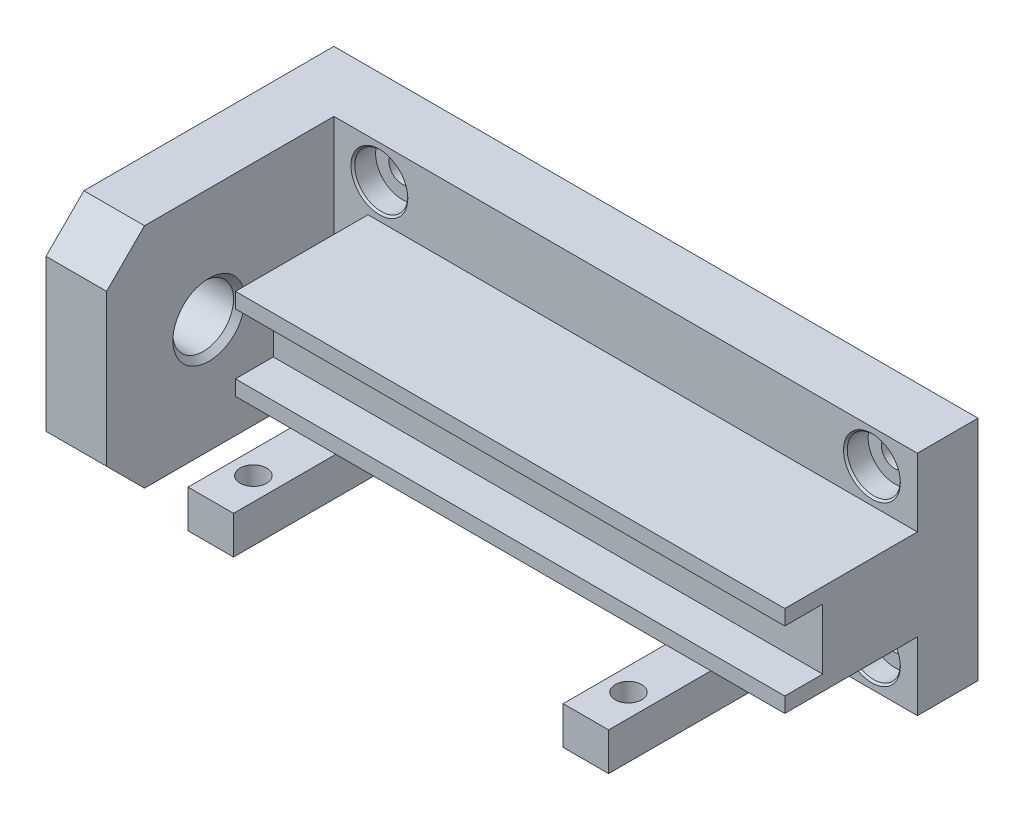
from build123d import *

# Parameters (mm, degrees)
CROQUIS1_W                                           = 85
CROQUIS1_H                                           = 30
EXTRUIR1_DEPTH                                       = 8
CROQUIS2_W                                           = 8
CROQUIS2_H                                           = 30
EXTRUIR2_DEPTH                                       = 30
CROQUIS3_W                                           = 72.5
CROQUIS3_H                                           = 12
EXTRUIR3_DEPTH                                       = 17.5
CROQUIS4_W                                           = 5
CROQUIS4_H                                           = 8
CORTAR_EXTRUIR1_DEPTH                                = 72.5
CHAFL_N1_SIZE                                        = 5
CROQUIS5_R                                           = 4
CORTAR_EXTRUIR2_DEPTH                                = 20
CHAFL_N2_SIZE                                        = 0.75
REFRENTADO_PARA_TORNILLO_DE_CABEZA_ALLEN_D           = 3.5
REFRENTADO_PARA_TORNILLO_DE_CABEZA_ALLEN_CBORE_D     = 7
REFRENTADO_PARA_TORNILLO_DE_CABEZA_ALLEN_CBORE_DEPTH = 3
CHAFL_N3_SIZE                                        = 0.25
CROQUIS9_W                                           = 6
CROQUIS9_H                                           = 5
SALIENTE_EXTRUIR1_DEPTH                              = 30
CROQUIS10_R                                          = 1.75
CORTAR_EXTRUIR3_DEPTH                                = 5
CROQUIS11_R                                          = 1.75
CORTAR_EXTRUIR4_DEPTH                                = 5


with BuildPart() as part:
    # Croquis1 → Extruir1 (new body)
    with BuildSketch(Plane.XY):
        Rectangle(CROQUIS1_W, CROQUIS1_H)
    extrude(amount=EXTRUIR1_DEPTH)

    # Croquis2 → Extruir2 (add)
    with BuildSketch(Plane.XY.offset(8)):
        with Locations((-38.5, 0)):
            Rectangle(CROQUIS2_W, CROQUIS2_H)
    extrude(amount=EXTRUIR2_DEPTH)

    # Croquis3 → Extruir3 (add)
    with BuildSketch(Plane.XY.offset(8)):
        with Locations((6.25, 0)):
            Rectangle(CROQUIS3_W, CROQUIS3_H)
    extrude(amount=EXTRUIR3_DEPTH)

    # Croquis4 → Cortar-Extruir1 (cut)
    with BuildSketch(Plane(origin=(42.5, 0, 0), x_dir=(0, 0, -1), z_dir=(1, 0, 0))):
        with Locations((-23, 0)):
            Rectangle(CROQUIS4_W, CROQUIS4_H)
    extrude(amount=-CORTAR_EXTRUIR1_DEPTH, mode=Mode.SUBTRACT)

    # Chaflán1
    chafl_n1_edges = [part.edges().sort_by_distance(p)[0] for p in [
        (-38.5, -15, 38),
        (-38.5, 15, 38),
    ]]
    chamfer(chafl_n1_edges, length=CHAFL_N1_SIZE)

    # Croquis5 → Cortar-Extruir2 (cut)
    with BuildSketch(Plane(origin=(-34.5, 0, 0), x_dir=(0, 0, -1), z_dir=(1, 0, 0))):
        with Locations(Location((-24.5, 0, 0), (0, 0, 90))):
            Circle(CROQUIS5_R)
    extrude(amount=-CORTAR_EXTRUIR2_DEPTH, mode=Mode.SUBTRACT)

    # Chaflán2
    chafl_n2_edges = [part.edges().sort_by_distance(p)[0] for p in [
        (-42.5, -4, 24.5),
        (-34.5, -4, 24.5),
    ]]
    chamfer(chafl_n2_edges, length=CHAFL_N2_SIZE)

    # Refrentado para tornillo de cabeza allen de M6-1 (through all)
    with Locations(Plane.XY.offset(8)):
        with Locations((-28.5, 10.5), (-28.5, -10.5), (36.5, -10.5), (36.5, 10.5)):
            CounterBoreHole(REFRENTADO_PARA_TORNILLO_DE_CABEZA_ALLEN_D / 2, REFRENTADO_PARA_TORNILLO_DE_CABEZA_ALLEN_CBORE_D / 2, REFRENTADO_PARA_TORNILLO_DE_CABEZA_ALLEN_CBORE_DEPTH)

    # Chaflán3
    chafl_n3_edges = [part.edges().sort_by_distance(p)[0] for p in [
        (-32, 10.5, 8),
        (33, 10.5, 8),
        (33, -10.5, 8),
        (-32, -10.5, 8),
    ]]
    chamfer(chafl_n3_edges, length=CHAFL_N3_SIZE)

    # Croquis9 → Saliente-Extruir1 (add)
    with BuildSketch(Plane.XY.offset(8)):
        with Locations((-20.75, -9.5)):
            Rectangle(CROQUIS9_W, CROQUIS9_H)
        with Locations((28.75, -9.5)):
            Rectangle(CROQUIS9_W, CROQUIS9_H)
    extrude(amount=SALIENTE_EXTRUIR1_DEPTH)

    # Croquis10 → Cortar-Extruir3 (cut)
    with BuildSketch(Plane(origin=(0, -7, 0), x_dir=(1, 0, 0), z_dir=(0, 1, 0))):
        with Locations(Location((-20.75, -32.38, 0), (0, 0, 270))):
            Circle(CROQUIS10_R)
    extrude(amount=-CORTAR_EXTRUIR3_DEPTH, mode=Mode.SUBTRACT)

    # Croquis11 → Cortar-Extruir4 (cut)
    with BuildSketch(Plane(origin=(0, -7, 0), x_dir=(1, 0, 0), z_dir=(0, 1, 0))):
        with Locations(Location((28.75, -32.38, 0), (0, 0, 270))):
            Circle(CROQUIS11_R)
    extrude(amount=-CORTAR_EXTRUIR4_DEPTH, mode=Mode.SUBTRACT)


solid = part.part
